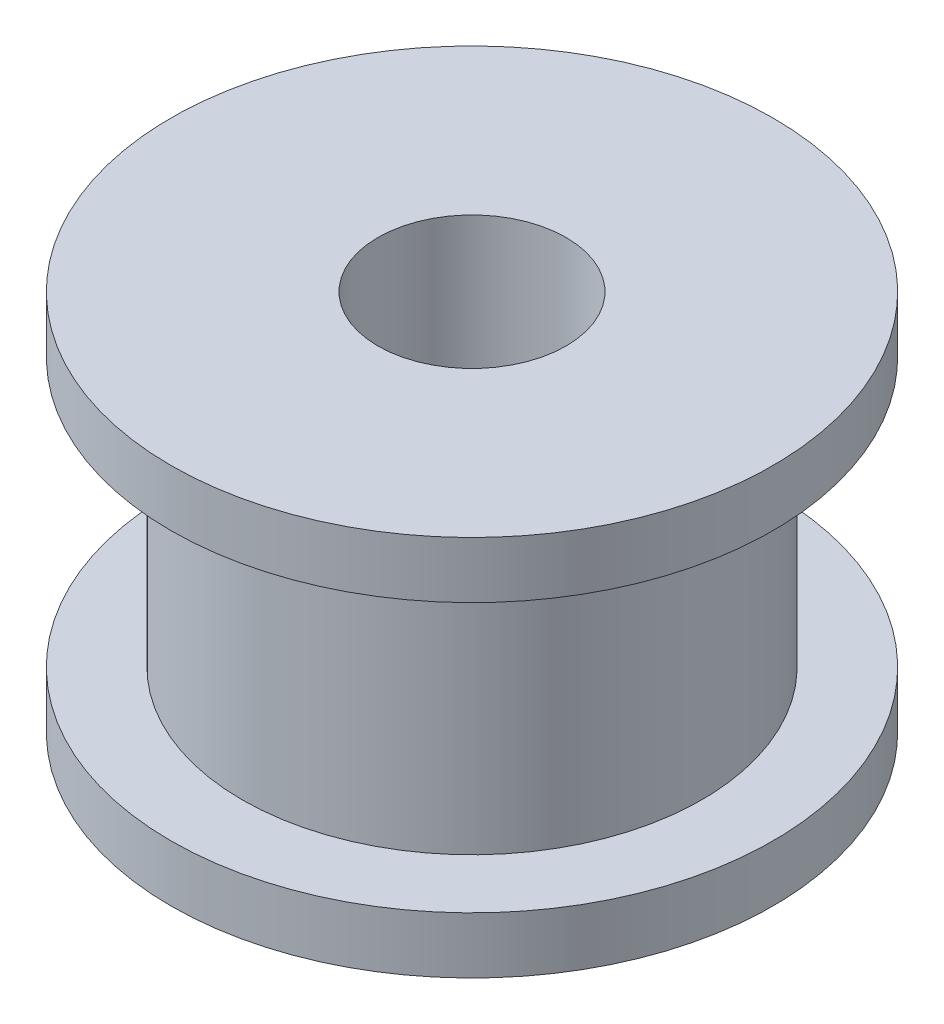
from build123d import *

# Parameters (mm, degrees)
SKETCH1_R               = 8
BOSS_EXTRUDE1_DEPTH     = 7.1
SKETCH2_R               = 6.11
BOSS_EXTRUDE2_DEPTH     = 7.14
SKETCH5_R               = 2.5
CUT_EXTRUDE2_DEPTH      = 16
SKETCH8_R               = 8
BOSS_EXTRUDE4_DEPTH     = 1.5
CUT_EXTRUDE4_START      = -15.74
SKETCH9_R               = 2.5
CUT_EXTRUDE4_DEPTH      = 15.74
CUT_EXTRUDE5_DEPTH      = 10
CUT_EXTRUDE5_DEPTH_BACK = 10
SKETCH10_W              = 16
SKETCH10_H              = 6


with BuildPart() as part:
    # Sketch1 → Boss-Extrude1 (new body)
    with BuildSketch(Plane(origin=(0, 0, 0), x_dir=(1, 0, 0), z_dir=(0, 1, 0))):
        with Locations(Location((0, 0, 0), (0, 0, 270))):
            Circle(SKETCH1_R)
    extrude(amount=BOSS_EXTRUDE1_DEPTH)

    # Sketch2 → Boss-Extrude2 (add)
    with BuildSketch(Plane(origin=(0, 7.1, 0), x_dir=(1, 0, 0), z_dir=(0, 1, 0))):
        with Locations(Location((0, 0, 0), (0, 0, 270))):
            Circle(SKETCH2_R)
    extrude(amount=BOSS_EXTRUDE2_DEPTH)

    # Sketch5 → Cut-Extrude2 (cut)
    with BuildSketch(Plane.XZ):
        with Locations(Location((0, 0, 0), (0, 0, 270))):
            Circle(SKETCH5_R)
    extrude(amount=-CUT_EXTRUDE2_DEPTH, mode=Mode.SUBTRACT)

    # Sketch8 → Boss-Extrude4 (add)
    with BuildSketch(Plane(origin=(0, 14.24, 0), x_dir=(1, 0, 0), z_dir=(0, 1, 0))):
        with Locations(Location((0, 0, 0), (0, 0, 270))):
            Circle(SKETCH8_R)
    extrude(amount=BOSS_EXTRUDE4_DEPTH)

    # Sketch9 → Cut-Extrude4 (cut)
    with BuildSketch(Plane(origin=(0, 15.74, 0), x_dir=(1, 0, 0), z_dir=(0, 1, 0)).offset(CUT_EXTRUDE4_START)):
        with Locations(Location((0, 0, 0), (0, 0, 90))):
            Circle(SKETCH9_R)
    extrude(amount=CUT_EXTRUDE4_DEPTH, mode=Mode.SUBTRACT)

    # Sketch10 → Cut-Extrude5 (cut, two sides: drawn at the far end of the back side and taken through both)
    with BuildSketch(Plane(origin=(0, 0, 0), x_dir=(0, 0, -1), z_dir=(1, 0, 0)).offset(-CUT_EXTRUDE5_DEPTH_BACK)):
        with Locations((0, 2.6)):
            Rectangle(SKETCH10_W, SKETCH10_H)
    extrude(amount=CUT_EXTRUDE5_DEPTH + CUT_EXTRUDE5_DEPTH_BACK, mode=Mode.SUBTRACT)


solid = part.part
